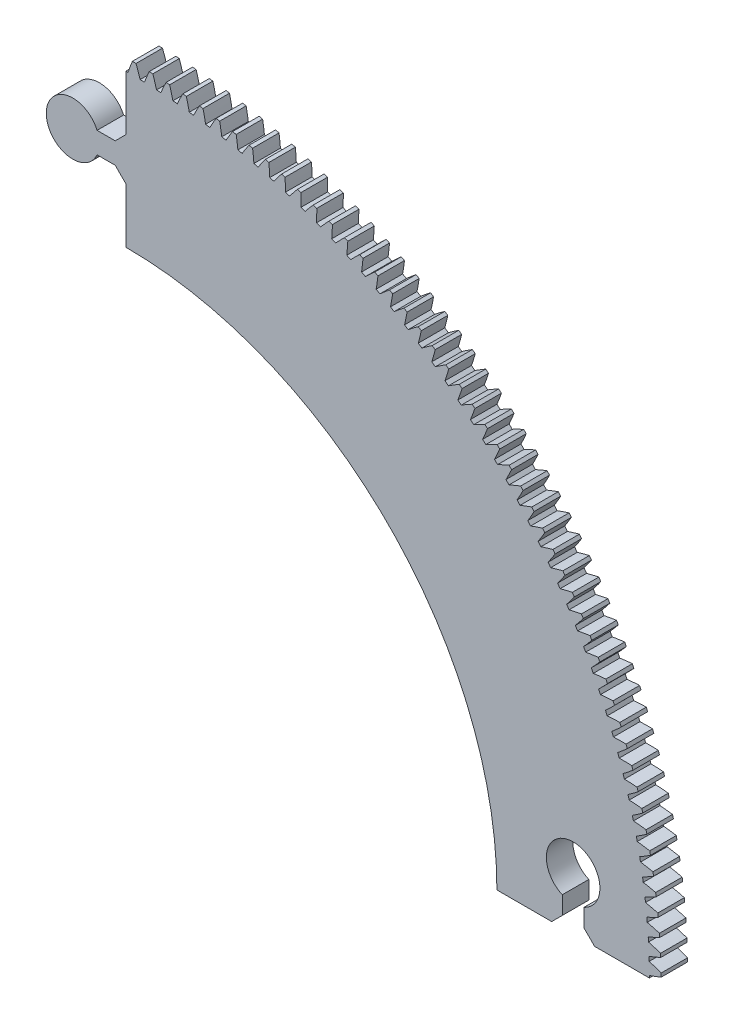
from build123d import *

# Parameters (mm, degrees)
BOSS_EXTRUDE1_DEPTH = 6.35
CHAMFER1_SIZE       = 2.54


with BuildPart() as part:
    # Sketch1 → Boss-Extrude1 (new body)
    with BuildSketch(Plane.XY):
        with BuildLine():
            Line((0, 88.9), (0, 104.6226))
            Line((0, 104.6226), (-6.880128867, 104.6226))
            ThreePointArc((-6.880128867, 104.6226), (-19.05, 107.1626), (-6.880128867, 109.7026))
            Line((-6.880128867, 109.7026), (0, 109.7026))
            Line((0, 109.7026), (0, 125.4252))
            ThreePointArc((0, 125.4252), (0.260260561, 125.424929976), (0.520520002, 125.424119905))
            ThreePointArc((0.520520002, 125.424119905), (1.031576754, 126.850099554), (1.584922511, 128.260207861))
            ThreePointArc((1.584922511, 128.260207861), (2.014777592, 128.254175648), (2.444610041, 128.24670281))
            ThreePointArc((2.444610041, 128.24670281), (2.953390183, 126.819909297), (3.419403656, 125.378580602))
            ThreePointArc((3.419403656, 125.378580602), (3.93970074, 125.363310235), (4.45992997, 125.345880745))
            ThreePointArc((4.45992997, 125.345880745), (5.015525649, 126.755104079), (5.612890936, 128.147135572))
            ThreePointArc((5.612890936, 128.147135572), (6.042344433, 128.127604261), (6.471730058, 128.106633747))
            ThreePointArc((6.471730058, 128.106633747), (6.93544248, 126.664563099), (7.355952775, 125.209307776))
            ThreePointArc((7.355952775, 125.209307776), (7.87551347, 125.177702018), (8.394938525, 125.143940334))
            ThreePointArc((8.394938525, 125.143940334), (8.994524826, 126.535016619), (9.635320115, 127.907597531))
            ThreePointArc((9.635320115, 127.907597531), (10.063948209, 127.874586398), (10.492463259, 127.840138903))
            ThreePointArc((10.492463259, 127.840138903), (10.910650333, 126.384214271), (11.285242458, 124.916468481))
            ThreePointArc((11.285242458, 124.916468481), (11.80355402, 124.868558523), (12.32166229, 124.818497962))
            ThreePointArc((12.32166229, 124.818497962), (12.964647493, 126.190054374), (13.648240397, 127.541830135))
            ThreePointArc((13.648240397, 127.541830135), (14.075620084, 127.495371756), (14.502841665, 127.447481276))
            ThreePointArc((14.502841665, 127.447481276), (14.875090692, 125.979139481), (15.203394968, 124.500351712))
            ThreePointArc((15.203394968, 124.500351712), (15.719945886, 124.436184835), (16.236226061, 124.369874802))
            ThreePointArc((16.236226061, 124.369874802), (16.921975618, 125.720557781), (17.647691513, 127.05019435))
            ThreePointArc((17.647691513, 127.05019435), (18.073401021, 126.990334575), (18.498907518, 126.929048372))
            ThreePointArc((18.498907518, 126.929048372), (18.824851132, 125.449738491), (19.106543563, 123.961368128))
            ThreePointArc((19.106543563, 123.961368128), (19.620824065, 123.881007657), (20.134766638, 123.798513592))
            ThreePointArc((20.134766638, 123.798513592), (20.862603796, 125.126990176), (21.629726488, 126.433175362))
            ThreePointArc((21.629726488, 126.433175362), (22.053345693, 126.359973266), (22.476717182, 126.285351822))
            ThreePointArc((22.476717182, 126.285351822), (22.756033716, 124.796533754), (22.990836307, 123.300049639))
            ThreePointArc((22.990836307, 123.300049639), (23.502338858, 123.20357488), (24.013436631, 123.104978194))
            ThreePointArc((24.013436631, 123.104978194), (24.782643103, 124.409937338), (25.590415534, 125.691382094))
            ThreePointArc((25.590415534, 125.691382094), (26.011526375, 125.604909918), (26.43234504, 125.517026876))
            ThreePointArc((26.43234504, 125.517026876), (26.664758843, 124.020169906), (26.85243987, 122.517048887))
            ThreePointArc((26.85243987, 122.517048887), (27.360659681, 122.40455505), (27.868408261, 122.289953046))
            ThreePointArc((27.868408261, 122.289953046), (28.678224934, 123.570106912), (29.52584993, 124.825546608))
            ThreePointArc((29.52584993, 124.825546608), (29.944036822, 124.725889689), (30.361887365, 124.624831778))
            ThreePointArc((30.361887365, 124.624831778), (30.547169072, 123.121413123), (30.687543318, 121.6131386))
            ThreePointArc((30.687543318, 121.6131386), (31.191978836, 121.484736701), (31.695877136, 121.354242479))
            ThreePointArc((31.695877136, 121.354242479), (32.545504818, 122.608327709), (33.432145877, 123.836523377))
            ThreePointArc((33.432145877, 123.836523377), (33.846996119, 123.723780066), (34.261466172, 123.609647017))
            ThreePointArc((34.261466172, 123.609647017), (34.399432933, 122.101150369), (34.492361865, 120.589210828))
            ThreePointArc((34.492361865, 120.589210828), (34.992515273, 120.445027585), (35.492066008, 120.298769925))
            ThreePointArc((35.492066008, 120.298769925), (36.380666219, 121.52554889), (37.305448332, 122.725288448))
            ThreePointArc((37.305448332, 122.725288448), (37.716552518, 122.599570008), (38.127233049, 122.472474459))
            ThreePointArc((38.127233049, 122.472474459), (38.217748706, 120.960388522), (38.263140615, 119.446276063))
            ThreePointArc((38.263140615, 119.446276063), (38.758518323, 119.286453768), (39.253228495, 119.12457701))
            ThreePointArc((39.253228495, 119.12457701), (40.179924294, 120.322839026), (41.141934813, 121.492938477))
            ThreePointArc((41.141934813, 121.492938477), (41.548887232, 121.354368977), (41.95537295, 121.214436354))
            ThreePointArc((41.95537295, 121.214436354), (41.998348176, 119.700253375), (41.996158265, 118.185462245))
            ThreePointArc((41.996158265, 118.185462245), (42.486271394, 118.010158622), (42.975652785, 117.832822519))
            ThreePointArc((42.975652785, 117.832822519), (43.939529636, 119.001385046), (44.937819172, 120.140689644))
            ThreePointArc((44.937819172, 120.140689644), (45.340218212, 119.989405835), (45.742107963, 119.836774235))
            ThreePointArc((45.742107963, 119.836774235), (45.737500347, 118.321988529), (45.687730777, 116.808013644))
            ThreePointArc((45.687730777, 116.808013644), (46.172095645, 116.617401698), (46.655665294, 116.424781258))
            ThreePointArc((46.655665294, 116.424781258), (47.655771966, 117.562491067), (48.689355329, 118.669876454))
            ThreePointArc((48.689355329, 118.669876454), (49.086803869, 118.506027635), (49.483701039, 118.340847688))
            ThreePointArc((49.483701039, 118.340847688), (49.431515127, 116.826954166), (49.334215015, 115.315289636))
            ThreePointArc((49.334215015, 115.315289636), (49.812353612, 115.109557477), (50.289634295, 114.901842794))
            ThreePointArc((50.289634295, 114.901842794), (51.324983803, 116.007577103), (52.39284097, 117.081950424))
            ThreePointArc((52.39284097, 117.081950424), (52.784946778, 116.905698294), (53.176459675, 116.728133012))
            ThreePointArc((53.176459675, 116.728133012), (53.076746969, 115.216625704), (52.932012339, 113.70876336))
            ThreePointArc((52.932012339, 113.70876336), (53.4034528, 113.488114021), (53.873973498, 113.265510084))
            ThreePointArc((53.873973498, 113.265510084), (54.943544077, 114.338177665), (56.044621203, 115.378478644))
            ThreePointArc((56.044621203, 115.378478644), (56.430997317, 115.189997143), (56.816739566, 115.000221761))
            ThreePointArc((56.816739566, 115.000221761), (56.669598471, 113.492592343), (56.477572157, 111.990020262))
            ThreePointArc((56.477572157, 111.990020262), (56.941849228, 111.754671498), (57.405145593, 111.51739799))
            ThreePointArc((57.405145593, 111.51739799), (58.507881707, 112.555940251), (59.641092161, 113.561142235))
            ThreePointArc((59.641092161, 113.561142235), (60.021357275, 113.360617371), (60.400948194, 113.158819176))
            ThreePointArc((60.400948194, 113.158819176), (60.20652392, 111.656555495), (59.96739543, 110.160756535))
            ThreePointArc((59.96739543, 110.160756535), (60.424050925, 109.910940606), (60.87966574, 109.659231688))
            ThreePointArc((60.87966574, 109.659231688), (62.014479121, 110.662623712), (63.178704562, 111.63173469))
            ThreePointArc((63.178704562, 111.63173469), (63.5524834, 111.419364357), (63.925548379, 111.205742497))
            ThreePointArc((63.925548379, 111.205742497), (63.684032799, 109.710327108), (63.398038124, 108.222777441))
            ThreePointArc((63.398038124, 108.222777441), (63.846621379, 107.958740885), (64.294105008, 107.692844963))
            ThreePointArc((64.294105008, 107.692844963), (65.459875732, 108.660096525), (66.653967209, 109.5921601))
            ThreePointArc((66.653967209, 109.5921601), (67.020890896, 109.368153882), (67.387061766, 109.142919177))
            ThreePointArc((67.387061766, 109.142919177), (67.098693226, 107.655827872), (66.766114608, 106.177995532))
            ThreePointArc((66.766114608, 106.177995532), (67.206182926, 105.899998922), (67.645093756, 105.620178403))
            ThreePointArc((67.645093756, 105.620178403), (68.840671348, 106.550334941), (70.063450438, 107.444431279))
            ThreePointArc((70.063450438, 107.444431279), (70.423156865, 107.209010243), (70.782072258, 106.972384973))
            ThreePointArc((70.782072258, 106.972384973), (70.447135344, 105.495085333), (70.068300998, 104.02842876))
            ThreePointArc((70.068300998, 104.02842876), (70.499420084, 103.736746445), (70.929324963, 103.443277478))
            ThreePointArc((70.929324963, 103.443277478), (72.153529533, 104.33542104), (73.403789499, 105.190667776))
            ThreePointArc((73.403789499, 105.190667776), (73.75592368, 104.944064254), (74.107229391, 104.69628194))
            ThreePointArc((74.107229391, 104.69628194), (73.726054645, 103.23023188), (73.301338434, 101.776198489))
            ThreePointArc((73.301338434, 101.776198489), (73.723082826, 101.471118323), (74.14355749, 101.164290527))
            ThreePointArc((74.14355749, 101.164290527), (75.395180895, 102.017540675), (76.671687883, 102.833093784))
            ThreePointArc((76.671687883, 102.833093784), (77.015902303, 102.575551144), (77.359251635, 102.316856317))
            ThreePointArc((77.359251635, 102.316856317), (76.932215231, 100.863502652), (76.462036299, 99.423527397))
            ThreePointArc((76.462036299, 99.423527397), (76.873989786, 99.105350458), (77.284619277, 98.785466635))
            ThreePointArc((77.284619277, 98.785466635), (78.562426316, 99.598981314), (79.863920568, 100.374035943))
            ThreePointArc((79.863920568, 100.374035943), (80.199875528, 100.105808349), (80.534929637, 99.836456309))
            ThreePointArc((80.534929637, 99.836456309), (80.062453008, 98.397233324), (79.547275366, 96.972737287))
            ThreePointArc((79.547275366, 96.972737287), (79.949031399, 96.641777578), (80.349410475, 96.309153414))
            ThreePointArc((80.349410475, 96.309153414), (81.652140108, 97.082129784), (82.977337205, 97.815921048))
            ThreePointArc((82.977337205, 97.815921048), (83.304701159, 97.537273208), (83.631129387, 97.257529772))
            ThreePointArc((83.631129387, 97.257529772), (83.11367881, 95.833857807), (82.554010875, 94.426246793))
            ThreePointArc((82.554010875, 94.426246793), (82.945172971, 94.082830931), (83.334906507, 93.737794686))
            ThreePointArc((83.334906507, 93.737794686), (84.661273095, 94.469469912), (86.008865228, 95.161273648))
            ThreePointArc((86.008865228, 95.161273648), (86.327315108, 94.872480553), (86.64479531, 94.582621796))
            ThreePointArc((86.64479531, 94.582621796), (86.082881446, 93.175905842), (85.479275543, 91.786568994))
            ThreePointArc((85.479275543, 91.786568994), (85.859457671, 91.431035888), (86.238161046, 91.073928072))
            ThreePointArc((86.238161046, 91.073928072), (87.586855627, 91.763580079), (88.955512885, 92.412713559))
            ThreePointArc((88.955512885, 92.412713559), (89.264734419, 92.114060214), (89.57295328, 91.81437219))
            ThreePointArc((89.57295328, 91.81437219), (88.967130671, 90.426000507), (88.320182486, 89.056308933))
            ThreePointArc((88.320182486, 89.056308933), (88.689009452, 88.689009452), (89.056308933, 88.320182486))
            ThreePointArc((89.056308933, 88.320182486), (90.426000507, 88.967130671), (91.81437219, 89.57295328))
            ThreePointArc((91.81437219, 89.57295328), (92.114060214, 89.264734419), (92.412713559, 88.955512885))
            ThreePointArc((92.412713559, 88.955512885), (91.763580079, 87.586855627), (91.073928072, 86.238161046))
            ThreePointArc((91.073928072, 86.238161046), (91.431035888, 85.859457671), (91.786568994, 85.479275543))
            ThreePointArc((91.786568994, 85.479275543), (93.175905842, 86.082881446), (94.582621796, 86.64479531))
            ThreePointArc((94.582621796, 86.64479531), (94.872480553, 86.327315108), (95.161273648, 86.008865228))
            ThreePointArc((95.161273648, 86.008865228), (94.469469912, 84.661273095), (93.737794686, 83.334906507))
            ThreePointArc((93.737794686, 83.334906507), (94.082830931, 82.945172971), (94.426246793, 82.554010875))
            ThreePointArc((94.426246793, 82.554010875), (95.833857807, 83.11367881), (97.257529772, 83.631129387))
            ThreePointArc((97.257529772, 83.631129387), (97.537273208, 83.304701159), (97.815921048, 82.977337205))
            ThreePointArc((97.815921048, 82.977337205), (97.082129784, 81.652140108), (96.309153414, 80.349410476))
            ThreePointArc((96.309153414, 80.349410476), (96.641777578, 79.949031399), (96.972737287, 79.547275366))
            ThreePointArc((96.972737287, 79.547275366), (98.397233324, 80.062453008), (99.836456309, 80.534929637))
            ThreePointArc((99.836456309, 80.534929637), (100.105808349, 80.199875528), (100.374035943, 79.863920568))
            ThreePointArc((100.374035943, 79.863920568), (99.598981314, 78.562426316), (98.785466635, 77.284619277))
            ThreePointArc((98.785466635, 77.284619277), (99.105350458, 76.873989786), (99.423527397, 76.462036299))
            ThreePointArc((99.423527397, 76.462036299), (100.863502652, 76.932215231), (102.316856317, 77.359251635))
            ThreePointArc((102.316856317, 77.359251635), (102.575551144, 77.015902303), (102.833093784, 76.671687883))
            ThreePointArc((102.833093784, 76.671687883), (102.017540675, 75.395180895), (101.164290527, 74.14355749))
            ThreePointArc((101.164290527, 74.14355749), (101.471118323, 73.723082826), (101.776198489, 73.301338434))
            ThreePointArc((101.776198489, 73.301338434), (103.23023188, 73.726054645), (104.69628194, 74.107229391))
            ThreePointArc((104.69628194, 74.107229391), (104.944064254, 73.75592368), (105.190667776, 73.403789499))
            ThreePointArc((105.190667776, 73.403789499), (104.33542104, 72.153529533), (103.443277478, 70.929324963))
            ThreePointArc((103.443277478, 70.929324963), (103.736746444, 70.499420084), (104.02842876, 70.068300998))
            ThreePointArc((104.02842876, 70.068300998), (105.495085333, 70.447135344), (106.972384973, 70.782072258))
            ThreePointArc((106.972384973, 70.782072258), (107.209010243, 70.423156865), (107.444431279, 70.063450438))
            ThreePointArc((107.444431279, 70.063450438), (106.550334941, 68.840671348), (105.620178403, 67.645093756))
            ThreePointArc((105.620178403, 67.645093756), (105.899998922, 67.206182926), (106.177995532, 66.766114608))
            ThreePointArc((106.177995532, 66.766114608), (107.655827872, 67.098693226), (109.142919177, 67.387061766))
            ThreePointArc((109.142919177, 67.387061766), (109.368153882, 67.020890896), (109.5921601, 66.653967209))
            ThreePointArc((109.5921601, 66.653967209), (108.660096525, 65.459875732), (107.692844963, 64.294105008))
            ThreePointArc((107.692844963, 64.294105008), (107.958740885, 63.846621379), (108.222777441, 63.398038124))
            ThreePointArc((108.222777441, 63.398038124), (109.710327107, 63.684032799), (111.205742497, 63.925548379))
            ThreePointArc((111.205742497, 63.925548379), (111.419364357, 63.5524834), (111.63173469, 63.178704562))
            ThreePointArc((111.63173469, 63.178704562), (110.662623712, 62.014479121), (109.659231688, 60.87966574))
            ThreePointArc((109.659231688, 60.87966574), (109.910940606, 60.424050925), (110.160756535, 59.96739543))
            ThreePointArc((110.160756535, 59.96739543), (111.656555495, 60.20652392), (113.158819176, 60.400948194))
            ThreePointArc((113.158819176, 60.400948194), (113.360617371, 60.021357275), (113.561142235, 59.641092161))
            ThreePointArc((113.561142235, 59.641092161), (112.555940251, 58.507881707), (111.51739799, 57.405145593))
            ThreePointArc((111.51739799, 57.405145593), (111.754671498, 56.941849228), (111.990020262, 56.477572157))
            ThreePointArc((111.990020262, 56.477572157), (113.492592343, 56.669598471), (115.000221761, 56.816739566))
            ThreePointArc((115.000221761, 56.816739566), (115.189997143, 56.430997317), (115.378478644, 56.044621203))
            ThreePointArc((115.378478644, 56.044621203), (114.338177665, 54.943544077), (113.265510084, 53.873973498))
            ThreePointArc((113.265510084, 53.873973498), (113.488114021, 53.4034528), (113.70876336, 52.932012339))
            ThreePointArc((113.70876336, 52.932012339), (115.216625704, 53.07674697), (116.728133012, 53.176459675))
            ThreePointArc((116.728133012, 53.176459675), (116.905698294, 52.784946778), (117.081950424, 52.39284097))
            ThreePointArc((117.081950424, 52.39284097), (116.007577103, 51.324983803), (114.901842794, 50.289634295))
            ThreePointArc((114.901842794, 50.289634295), (115.109557477, 49.812353612), (115.315289636, 49.334215015))
            ThreePointArc((115.315289636, 49.334215015), (116.826954166, 49.431515127), (118.340847688, 49.483701039))
            ThreePointArc((118.340847688, 49.483701039), (118.506027635, 49.086803869), (118.669876454, 48.689355329))
            ThreePointArc((118.669876454, 48.689355329), (117.562491067, 47.655771966), (116.424781258, 46.655665294))
            ThreePointArc((116.424781258, 46.655665294), (116.617401698, 46.172095645), (116.808013644, 45.687730777))
            ThreePointArc((116.808013644, 45.687730777), (118.321988529, 45.737500347), (119.836774235, 45.742107963))
            ThreePointArc((119.836774235, 45.742107963), (119.989405835, 45.340218212), (120.140689644, 44.937819172))
            ThreePointArc((120.140689644, 44.937819172), (119.001385046, 43.939529636), (117.832822519, 42.975652785))
            ThreePointArc((117.832822519, 42.975652785), (118.010158622, 42.486271394), (118.185462245, 41.996158265))
            ThreePointArc((118.185462245, 41.996158265), (119.700253375, 41.998348176), (121.214436354, 41.95537295))
            ThreePointArc((121.214436354, 41.95537295), (121.354368977, 41.548887232), (121.492938477, 41.141934813))
            ThreePointArc((121.492938477, 41.141934813), (120.322839026, 40.179924294), (119.12457701, 39.253228495))
            ThreePointArc((119.12457701, 39.253228495), (119.286453768, 38.758518323), (119.446276063, 38.263140615))
            ThreePointArc((119.446276063, 38.263140615), (120.960388522, 38.217748706), (122.472474459, 38.127233049))
            ThreePointArc((122.472474459, 38.127233049), (122.599570008, 37.716552518), (122.725288448, 37.305448332))
            ThreePointArc((122.725288448, 37.305448332), (121.52554889, 36.380666219), (120.298769925, 35.492066008))
            ThreePointArc((120.298769925, 35.492066008), (120.445027585, 34.992515273), (120.589210828, 34.492361865))
            ThreePointArc((120.589210828, 34.492361865), (122.101150369, 34.399432933), (123.609647017, 34.261466172))
            ThreePointArc((123.609647017, 34.261466172), (123.723780066, 33.846996119), (123.836523377, 33.432145877))
            ThreePointArc((123.836523377, 33.432145877), (122.608327709, 32.545504818), (121.354242479, 31.695877136))
            ThreePointArc((121.354242479, 31.695877136), (121.484736701, 31.191978836), (121.6131386, 30.687543318))
            ThreePointArc((121.6131386, 30.687543318), (123.121413123, 30.547169072), (124.624831778, 30.361887365))
            ThreePointArc((124.624831778, 30.361887365), (124.725889689, 29.944036822), (124.825546608, 29.52584993))
            ThreePointArc((124.825546608, 29.52584993), (123.570106912, 28.678224934), (122.289953046, 27.868408261))
            ThreePointArc((122.289953046, 27.868408261), (122.40455505, 27.360659681), (122.517048887, 26.85243987))
            ThreePointArc((122.517048887, 26.85243987), (124.020169906, 26.664758843), (125.517026876, 26.43234504))
            ThreePointArc((125.517026876, 26.43234504), (125.604909918, 26.011526375), (125.691382094, 25.590415534))
            ThreePointArc((125.691382094, 25.590415534), (124.409937338, 24.782643103), (123.104978194, 24.013436631))
            ThreePointArc((123.104978194, 24.013436631), (123.20357488, 23.502338858), (123.300049639, 22.990836307))
            ThreePointArc((123.300049639, 22.990836307), (124.796533754, 22.756033716), (126.285351822, 22.476717182))
            ThreePointArc((126.285351822, 22.476717182), (126.359973266, 22.053345693), (126.433175362, 21.629726488))
            ThreePointArc((126.433175362, 21.629726488), (125.126990176, 20.862603797), (123.798513592, 20.134766638))
            ThreePointArc((123.798513592, 20.134766638), (123.881007657, 19.620824065), (123.961368128, 19.106543563))
            ThreePointArc((123.961368128, 19.106543563), (125.449738491, 18.824851132), (126.929048372, 18.498907518))
            ThreePointArc((126.929048372, 18.498907518), (126.990334575, 18.073401021), (127.05019435, 17.647691513))
            ThreePointArc((127.05019435, 17.647691513), (125.720557781, 16.921975618), (124.369874802, 16.236226061))
            ThreePointArc((124.369874802, 16.236226061), (124.436184835, 15.719945886), (124.500351712, 15.203394968))
            ThreePointArc((124.500351712, 15.203394968), (125.979139481, 14.875090692), (127.447481276, 14.502841665))
            ThreePointArc((127.447481276, 14.502841665), (127.495371756, 14.075620084), (127.541830135, 13.648240397))
            ThreePointArc((127.541830135, 13.648240397), (126.190054374, 12.964647493), (124.818497962, 12.32166229))
            ThreePointArc((124.818497962, 12.32166229), (124.868558523, 11.80355402), (124.916468481, 11.285242458))
            ThreePointArc((124.916468481, 11.285242458), (126.384214271, 10.910650333), (127.840138903, 10.492463259))
            ThreePointArc((127.840138903, 10.492463259), (127.874586398, 10.063948209), (127.907597531, 9.635320115))
            ThreePointArc((127.907597531, 9.635320115), (126.535016619, 8.994524826), (125.143940334, 8.394938525))
            ThreePointArc((125.143940334, 8.394938525), (125.177702018, 7.87551347), (125.209307776, 7.355952775))
            ThreePointArc((125.209307776, 7.355952775), (126.664563099, 6.93544248), (128.106633747, 6.471730058))
            ThreePointArc((128.106633747, 6.471730058), (128.127604261, 6.042344433), (128.147135572, 5.612890936))
            ThreePointArc((128.147135572, 5.612890936), (126.755104079, 5.015525649), (125.345880745, 4.45992997))
            ThreePointArc((125.345880745, 4.45992997), (125.363310235, 3.93970074), (125.378580602, 3.419403656))
            ThreePointArc((125.378580602, 3.419403656), (126.819909297, 2.953390183), (128.24670281, 2.444610041))
            ThreePointArc((128.24670281, 2.444610041), (128.254175648, 2.014777592), (128.260207861, 1.584922511))
            ThreePointArc((128.260207861, 1.584922511), (126.850099554, 1.031576754), (125.424119905, 0.520520002))
            ThreePointArc((125.424119905, 0.520520002), (125.424929976, 0.260260561), (125.4252, 0))
            Line((125.4252, 0), (109.7661, 0))
            Line((109.7661, 0), (109.7661, 6.838705774))
            ThreePointArc((109.7661, 6.838705774), (107.1626, 19.1135), (104.5591, 6.838705774))
            Line((104.5591, 6.838705774), (104.5591, 0))
            Line((104.5591, 0), (88.9, 0))
            ThreePointArc((88.9, 0), (62.861792847, 62.861792847), (0, 88.9))
        make_face()
    extrude(amount=BOSS_EXTRUDE1_DEPTH)

    # Chamfer1
    chamfer1_edges = [part.edges().sort_by_distance(p)[0] for p in [
        (109.7661, 0, 3.175),
        (104.5591, 0, 3.175),
        (0, 104.6226, 3.175),
        (0, 109.7026, 3.175),
    ]]
    chamfer(chamfer1_edges, length=CHAMFER1_SIZE)


solid = part.part
